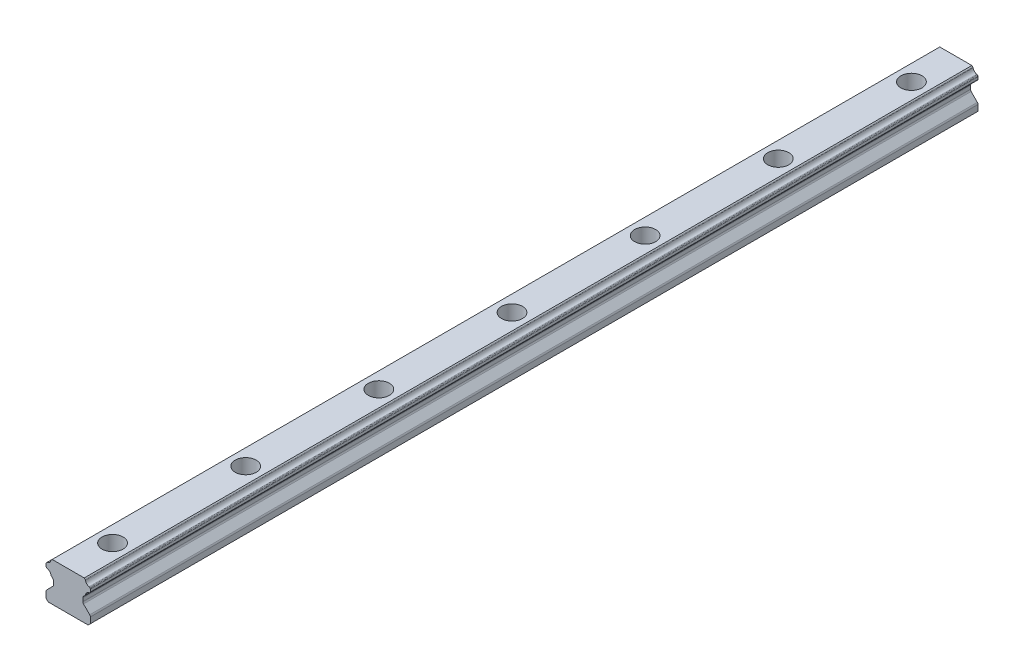
from build123d import *

# Parameters (mm, degrees)
EXTRUDE_1_DEPTH           = 400
HOLE_WIZARD_1_D           = 6
HOLE_WIZARD_1_CBORE_D     = 9.5
HOLE_WIZARD_1_CBORE_DEPTH = 8.5
PATTERN_LINEAR_1_COUNT    = 7
PATTERN_LINEAR_1_PITCH    = 60


with BuildPart() as part:
    # 草图1 → 凸台-拉伸1 (new body)
    with BuildSketch(Plane.XY):
        with BuildLine():
            Line((0.146446607, 14.877167225), (0.33665166, 15.067372278))
            ThreePointArc((0.33665166, 15.067372278), (0.456581276, 15.155881832), (0.597272425, 15.205106231))
            ThreePointArc((0.597272425, 15.205106231), (1.655392341, 15.764307144), (2.214593278, 16.822427055))
            ThreePointArc((2.214593278, 16.822427055), (2.263817599, 16.96311829), (2.3523274, 17.083047759))
            Line((2.3523274, 17.083047759), (2.769279462, 17.499999821))
            Line((2.769279462, 17.499999821), (17.230720684, 17.499999821))
            Line((17.230720684, 17.499999821), (17.647672747, 17.083047759))
            ThreePointArc((17.647672747, 17.083047759), (17.736182286, 16.963118168), (17.785406689, 16.822427051))
            ThreePointArc((17.785406689, 16.822427051), (18.344607694, 15.764307233), (19.402727615, 15.205106406))
            ThreePointArc((19.402727615, 15.205106406), (19.54341887, 15.155882087), (19.663348354, 15.067372278))
            Line((19.663348354, 15.067372278), (19.853553407, 14.877167225))
            ThreePointArc((19.853553407, 14.877167225), (19.961939783, 14.714955551), (20.000000017, 14.523613835))
            Line((20.000000017, 14.523613835), (20.000000017, 13.466386174))
            ThreePointArc((20.000000017, 13.466386174), (19.961939783, 13.275044458), (19.853553407, 13.112832784))
            Line((19.853553407, 13.112832784), (19.675343411, 12.934622787))
            ThreePointArc((19.675343411, 12.934622787), (19.554347233, 12.845550893), (19.412352183, 12.796446074))
            ThreePointArc((19.412352183, 12.796446074), (18.344607801, 12.23544862), (17.783610347, 11.167704238))
            ThreePointArc((17.783610347, 11.167704238), (17.734505529, 11.025709189), (17.645433635, 10.904713011))
            Line((17.645433635, 10.904713011), (16.892893236, 10.152172612))
            ThreePointArc((16.892893236, 10.152172612), (16.676120484, 9.827749263), (16.600000023, 9.44506583))
            Line((16.600000023, 9.44506583), (16.600000023, 7.884934177))
            ThreePointArc((16.600000023, 7.884934177), (16.67612049, 7.502250748), (16.892893231, 7.177827393))
            Line((16.892893231, 7.177827393), (19.707106793, 4.363613831))
            ThreePointArc((19.707106793, 4.363613831), (19.923879539, 4.039190479), (20.000000006, 3.656507049))
            Line((20.000000006, 3.656507049), (20.000000006, 1))
            Line((20.000000006, 1), (19.000000006, 0))
            Line((19.000000006, 0), (1.000000006, 0))
            Line((1.000000006, 0), (6e-09, 1))
            Line((6e-09, 1), (6e-09, 3.656507049))
            ThreePointArc((6e-09, 3.656507049), (0.076120462, 4.039190482), (0.292893214, 4.363613832))
            Line((0.292893214, 4.363613832), (3.107106776, 7.177827394))
            ThreePointArc((3.107106776, 7.177827394), (3.323879528, 7.502250744), (3.399999989, 7.884934177))
            Line((3.399999989, 7.884934177), (3.399999989, 9.44506583))
            ThreePointArc((3.399999989, 9.44506583), (3.323879522, 9.827749259), (3.107106778, 10.152172612))
            Line((3.107106778, 10.152172612), (2.35456638, 10.904713011))
            ThreePointArc((2.35456638, 10.904713011), (2.265494485, 11.025709189), (2.216389667, 11.167704238))
            ThreePointArc((2.216389667, 11.167704238), (1.655392213, 12.235448621), (0.587647831, 12.796446074))
            ThreePointArc((0.587647831, 12.796446074), (0.445652781, 12.845550893), (0.324656604, 12.934622787))
            Line((0.324656604, 12.934622787), (0.146446607, 13.112832784))
            ThreePointArc((0.146446607, 13.112832784), (0.038060231, 13.275044458), (-3e-09, 13.466386175))
            Line((-3e-09, 13.466386175), (-3e-09, 14.523613835))
            ThreePointArc((-3e-09, 14.523613835), (0.038060231, 14.714955551), (0.146446607, 14.877167225))
        make_face()
    extrude(amount=-EXTRUDE_1_DEPTH)

    # 打孔尺寸根据内六角圆柱头螺钉的类型1 (through all)
    with Locations(Plane(origin=(0, 17.499999821, 0), x_dir=(1, 0, 0), z_dir=(0, 1, 0))):
        with Locations((10.000000073, 20)):
            hole_wizard_1 = CounterBoreHole(HOLE_WIZARD_1_D / 2, HOLE_WIZARD_1_CBORE_D / 2, HOLE_WIZARD_1_CBORE_DEPTH)

    # 阵列(线性)1: 打孔尺寸根据内六角圆柱头螺钉的类型1 ×7
    with Locations(*[(0, 0, -i * PATTERN_LINEAR_1_PITCH) for i in range(1, PATTERN_LINEAR_1_COUNT)]):
        add(hole_wizard_1, mode=Mode.SUBTRACT)


solid = part.part
